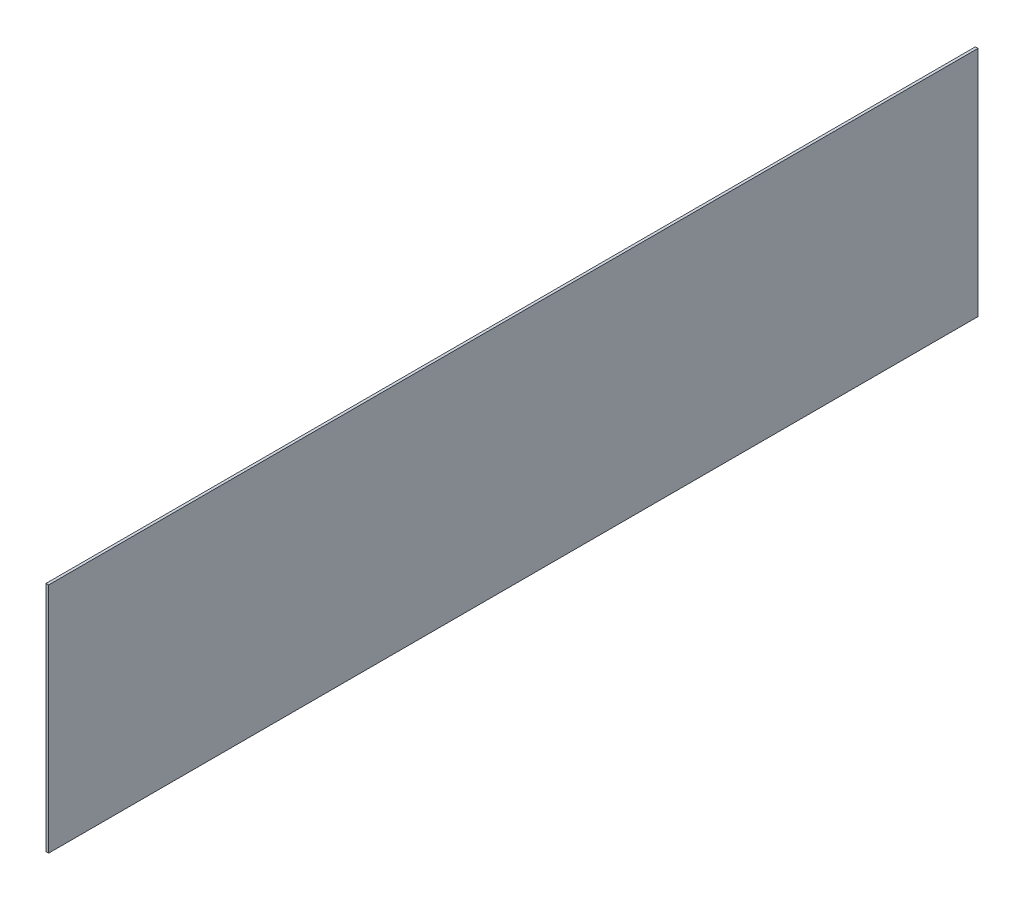
from build123d import *

# Parameters (mm, degrees)
SKETCH1_W           = 558.8
SKETCH1_H           = 139.7
BOSS_EXTRUDE1_DEPTH = 1.5875


with BuildPart() as part:
    # Sketch1 → Boss-Extrude1 (new body)
    with BuildSketch(Plane(origin=(0, 0, 0), x_dir=(0, 0, -1), z_dir=(1, 0, 0))):
        with Locations((279.4, 69.85)):
            Rectangle(SKETCH1_W, SKETCH1_H)
    extrude(amount=BOSS_EXTRUDE1_DEPTH)


solid = part.part
